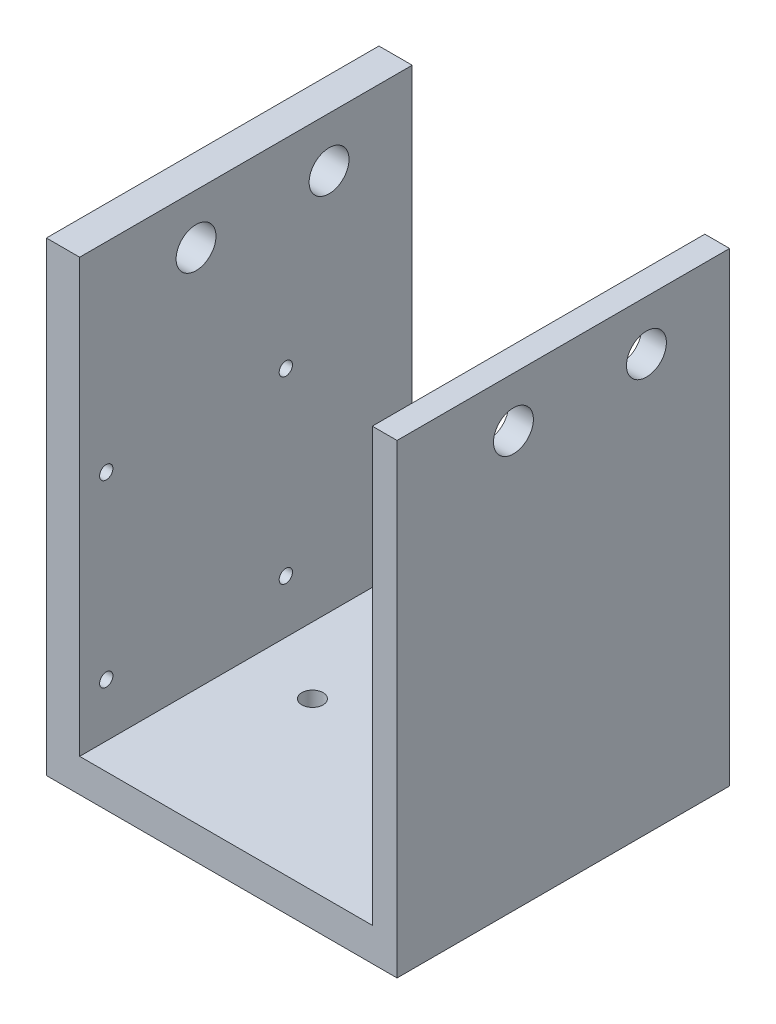
from build123d import *

# Parameters (mm, degrees)
EXTRUDE_1_DEPTH          = 50
SKETCH_2_R               = 1
CUT_EXTRUDE_1_DEPTH      = 97.622978633
SKETCH_3_R               = 1.6
CUT_EXTRUDE_2_DEPTH      = 99.031557982
CUT_EXTRUDE_3_DEPTH      = 97.622978633
CUT_EXTRUDE_3_DEPTH_BACK = 97.622978633
SKETCH_4_R               = 3
EXTRUDE_2_DEPTH          = 50
SKETCH_6_R               = 3
CUT_EXTRUDE_4_DEPTH      = 100


with BuildPart() as part:
    # ｽｹｯﾁ1 → ﾎﾞｽ - 押し出し1 (new body)
    with BuildSketch(Plane.XY):
        Polygon((-53.713930785, 70), (-53.713930785, 0), (-4.713930785, 0), (-4.713930785, 5), (-48.713930785, 5), (-48.713930785, 70), align=None)
    extrude(amount=EXTRUDE_1_DEPTH)

    # ｽｹｯﾁ2 → ｶｯﾄ - 押し出し1 (cut, through all)
    with BuildSketch(Plane(origin=(-48.713930785, 0, 0), x_dir=(0, 0, -1), z_dir=(1, 0, 0))):
        with Locations(Location((-46, 40, 0), (0, 0, 90))):
            Circle(SKETCH_2_R)
        with Locations(Location((-19, 40, 0), (0, 0, 90))):
            Circle(SKETCH_2_R)
        with Locations(Location((-19, 13, 0), (0, 0, 90))):
            Circle(SKETCH_2_R)
        with Locations(Location((-46, 13, 0), (0, 0, 90))):
            Circle(SKETCH_2_R)
    extrude(amount=-CUT_EXTRUDE_1_DEPTH, mode=Mode.SUBTRACT)

    # ｽｹｯﾁ3 → ｶｯﾄ - 押し出し2 (cut, through all)
    with BuildSketch(Plane(origin=(0, 5, 0), x_dir=(1, 0, 0), z_dir=(0, 1, 0))):
        with Locations(Location((-38.713930785, -25, 0), (0, 0, 180))):
            Circle(SKETCH_3_R)
        with Locations(Location((-23.713930785, -25, 0), (0, 0, 180))):
            Circle(SKETCH_3_R)
    extrude(amount=-CUT_EXTRUDE_2_DEPTH, mode=Mode.SUBTRACT)

    # ｽｹｯﾁ4 → ｶｯﾄ - 押し出し3 (cut, two sides: drawn at the far end of the back side and taken through both)
    with BuildSketch(Plane(origin=(-48.713930785, 0, 0), x_dir=(0, 0, -1), z_dir=(1, 0, 0)).offset(-CUT_EXTRUDE_3_DEPTH_BACK)):
        with Locations((-32.5, 62.5)):
            Circle(SKETCH_4_R)
        with Locations((-12.5, 62.5)):
            Circle(SKETCH_4_R)
    extrude(amount=CUT_EXTRUDE_3_DEPTH + CUT_EXTRUDE_3_DEPTH_BACK, mode=Mode.SUBTRACT)

    # ｽｹｯﾁ5 → ﾎﾞｽ - 押し出し2 (add)
    with BuildSketch(Plane.XY.offset(50)):
        Polygon((-4.713930785, 5), (-4.713930785, 70), (-0.989780717, 70), (-0.989780717, 0), (-4.713930785, 0), align=None)
    extrude(amount=-EXTRUDE_2_DEPTH)

    # ｽｹｯﾁ6 → ｶｯﾄ - 押し出し4 (cut, through all)
    with BuildSketch(Plane.ZY.offset(4.713930785)):
        with Locations(Location((12.5, 62.5, 0), (0, 0, 180))):
            Circle(SKETCH_6_R)
        with Locations(Location((32.5, 62.5, 0), (0, 0, 180))):
            Circle(SKETCH_6_R)
    extrude(amount=-CUT_EXTRUDE_4_DEPTH, mode=Mode.SUBTRACT)


solid = part.part
